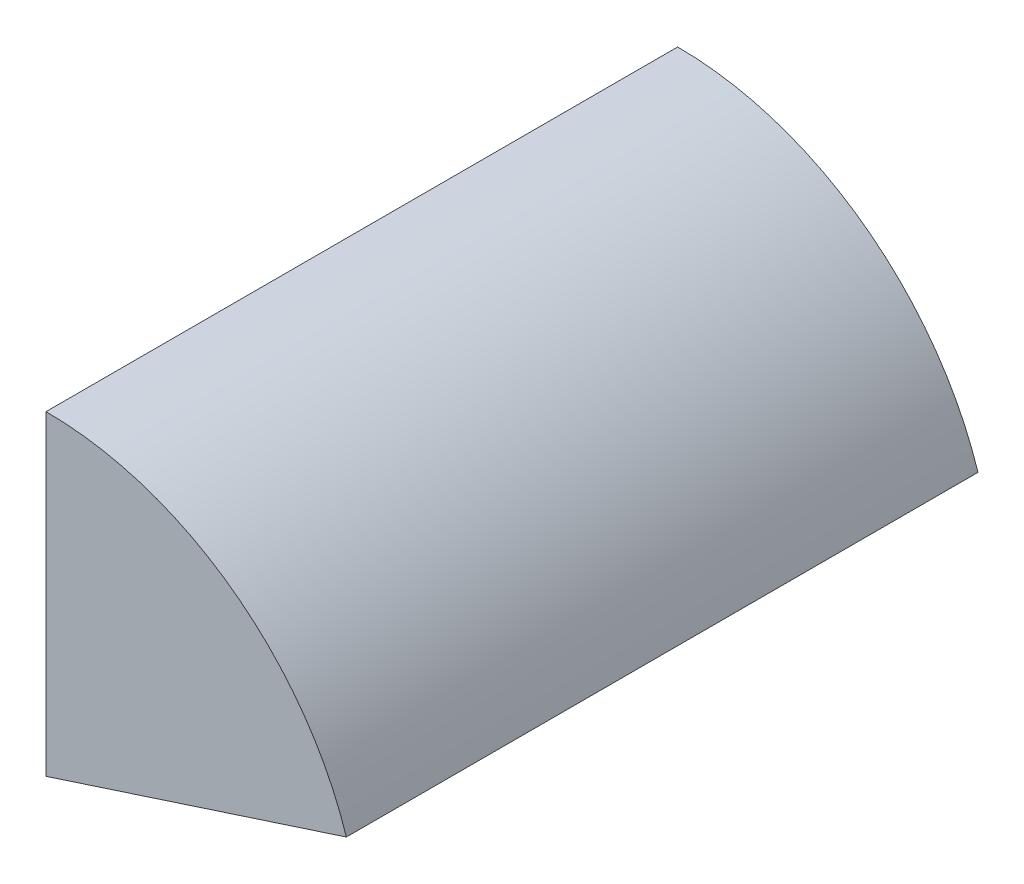
from build123d import *

# Parameters (mm, degrees)
SALIENTE_EXTRUIR1_DEPTH = 50
CROQUIS2_R              = 5
CORTAR_EXTRUIR1_DEPTH   = 10


with BuildPart() as part:
    # Croquis1 → Saliente-Extruir1 (new body)
    with BuildSketch(Plane.XY):
        with BuildLine():
            Line((0, 25), (0, 0))
            Line((0, 0), (23.776412907, 7.725424859))
            ThreePointArc((23.776412907, 7.725424859), (14.694631307, 20.225424859), (0, 25))
        make_face()
    extrude(amount=SALIENTE_EXTRUIR1_DEPTH)

    # Croquis2 → Cortar-Extruir1 (cut)
    with BuildSketch(Plane(origin=(0, 0, 0), x_dir=(-1, 0, 0), z_dir=(0, 0, -1))):
        with Locations((-8.730834775, 12.290776576)):
            Circle(CROQUIS2_R)
    extrude(amount=-CORTAR_EXTRUIR1_DEPTH, mode=Mode.SUBTRACT)


solid = part.part
